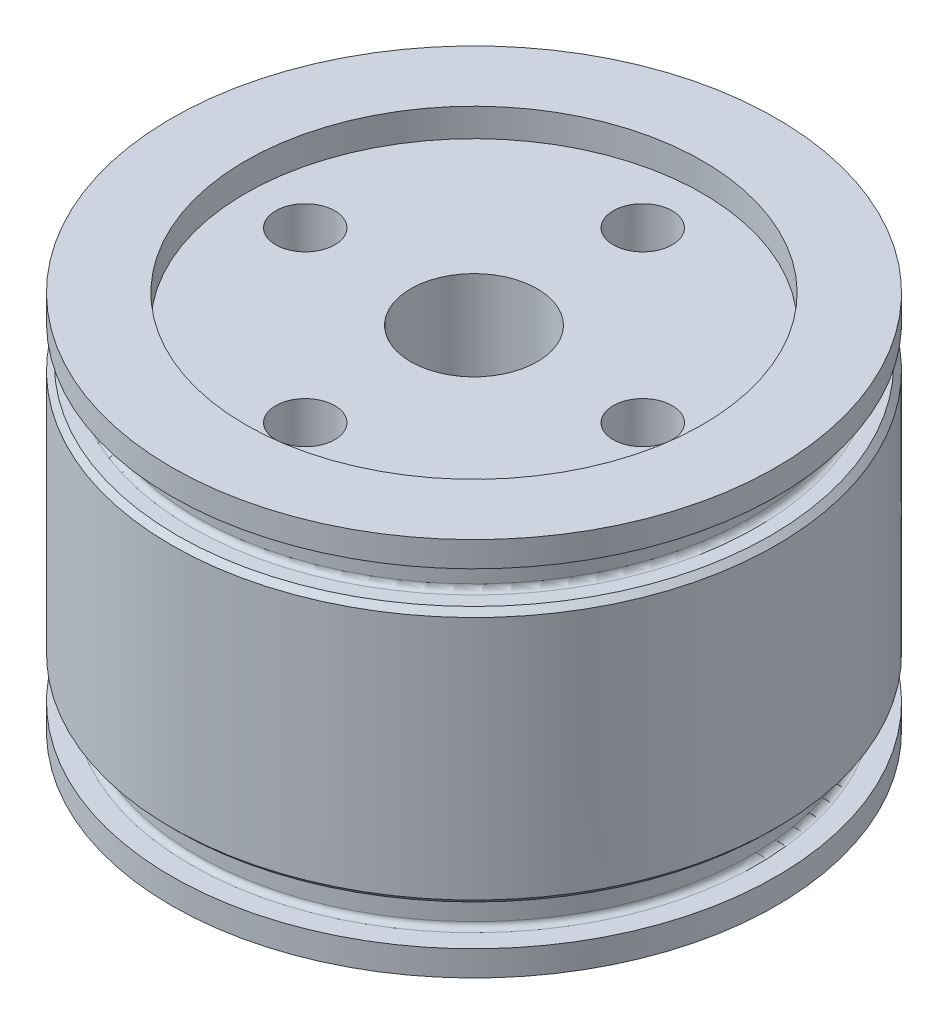
from build123d import *

# Parameters (mm, degrees)
SKETCH1_R           = 21.5
SKETCH1_R_2         = 4.5
SKETCH1_R_3         = 2.1
BOSS_EXTRUDE1_DEPTH = 27
CUT_EXTRUDE1_DEPTH  = 22
SKETCH3_R           = 16.25
CUT_EXTRUDE2_DEPTH  = 2
SKETCH6_R           = 21.5
SKETCH6_R_2         = 19.7
CUT_EXTRUDE3_DEPTH  = 2.6
CUT_EXTRUDE4_START  = -2.6
SKETCH7_R           = 21.5
SKETCH7_R_2         = 19.7
CUT_EXTRUDE4_DEPTH  = 2.6
FILLET1_R           = 0.4
CHAMFER1_SIZE       = 0.4


with BuildPart() as part:
    # Sketch1 → Boss-Extrude1 (new body)
    with BuildSketch(Plane(origin=(0, 0, 0), x_dir=(1, 0, 0), z_dir=(0, 1, 0))):
        with Locations(Location((0, 0, 0), (0, 0, 270))):
            Circle(SKETCH1_R)
        with Locations(Location((0, 0, 0), (0, 0, 270))):
            Circle(SKETCH1_R_2, mode=Mode.SUBTRACT)
        with Locations(Location((0, 12, 0), (0, 0, 270))):
            Circle(SKETCH1_R_3, mode=Mode.SUBTRACT)
        with Locations(Location((12, 0, 0), (0, 0, 270))):
            Circle(SKETCH1_R_3, mode=Mode.SUBTRACT)
        with Locations(Location((0, -12, 0), (0, 0, 270))):
            Circle(SKETCH1_R_3, mode=Mode.SUBTRACT)
        with Locations(Location((-12, 0, 0), (0, 0, 270))):
            Circle(SKETCH1_R_3, mode=Mode.SUBTRACT)
    extrude(amount=BOSS_EXTRUDE1_DEPTH)

    # Sketch2 → Cut-Extrude1 (cut)
    with BuildSketch(Plane.XZ):
        Polygon((12, -4.156921938), (15.6, -2.078460969), (15.6, 2.078460969), (12, 4.156921938), (8.4, 2.078460969), (8.4, -2.078460969), align=None)
        Polygon((4.156921938, 12), (2.078460969, 15.6), (-2.078460969, 15.6), (-4.156921938, 12), (-2.078460969, 8.4), (2.078460969, 8.4), align=None)
        Polygon((-4.156921938, -12), (-2.078460969, -15.6), (2.078460969, -15.6), (4.156921938, -12), (2.078460969, -8.4), (-2.078460969, -8.4), align=None)
        Polygon((-12, 4.156921938), (-15.6, 2.078460969), (-15.6, -2.078460969), (-12, -4.156921938), (-8.4, -2.078460969), (-8.4, 2.078460969), align=None)
    extrude(amount=-CUT_EXTRUDE1_DEPTH, mode=Mode.SUBTRACT)

    # Sketch3 → Cut-Extrude2 (cut)
    with BuildSketch(Plane(origin=(0, 27, 0), x_dir=(1, 0, 0), z_dir=(0, 1, 0))):
        with Locations(Location((0, 0, 0), (0, 0, 270))):
            Circle(SKETCH3_R)
    extrude(amount=-CUT_EXTRUDE2_DEPTH, mode=Mode.SUBTRACT)

    # Sketch6 → Cut-Extrude3 (cut)
    with BuildSketch(Plane(origin=(0, 1.8, 0), x_dir=(-1, 0, 0), z_dir=(0, -1, 0))):
        with Locations(Location((0, 0, 0), (0, 0, 90))):
            Circle(SKETCH6_R)
        with Locations(Location((0, 0, 0), (0, 0, 90))):
            Circle(SKETCH6_R_2, mode=Mode.SUBTRACT)
    extrude(amount=-CUT_EXTRUDE3_DEPTH, mode=Mode.SUBTRACT)

    # Sketch7 → Cut-Extrude4 (cut)
    with BuildSketch(Plane(origin=(0, 25.2, 0), x_dir=(1, 0, 0), z_dir=(0, 1, 0)).offset(CUT_EXTRUDE4_START)):
        with Locations(Location((0, 0, 0), (0, 0, 90))):
            Circle(SKETCH7_R)
        with Locations(Location((0, 0, 0), (0, 0, 90))):
            Circle(SKETCH7_R_2, mode=Mode.SUBTRACT)
    extrude(amount=CUT_EXTRUDE4_DEPTH, mode=Mode.SUBTRACT)

    # Fillet1
    fillet1_edges = [part.edges().sort_by_distance(p)[0] for p in [
        (0, 4.4, 19.7),
        (0, 1.8, 19.7),
        (0, 22.6, 19.7),
        (0, 25.2, 19.7),
    ]]
    fillet(fillet1_edges, radius=FILLET1_R)

    # Chamfer1
    chamfer1_edges = [part.edges().sort_by_distance(p)[0] for p in [
        (0, 4.4, -21.5),
        (0, 22.6, -21.5),
    ]]
    chamfer(chamfer1_edges, length=CHAMFER1_SIZE)


solid = part.part
